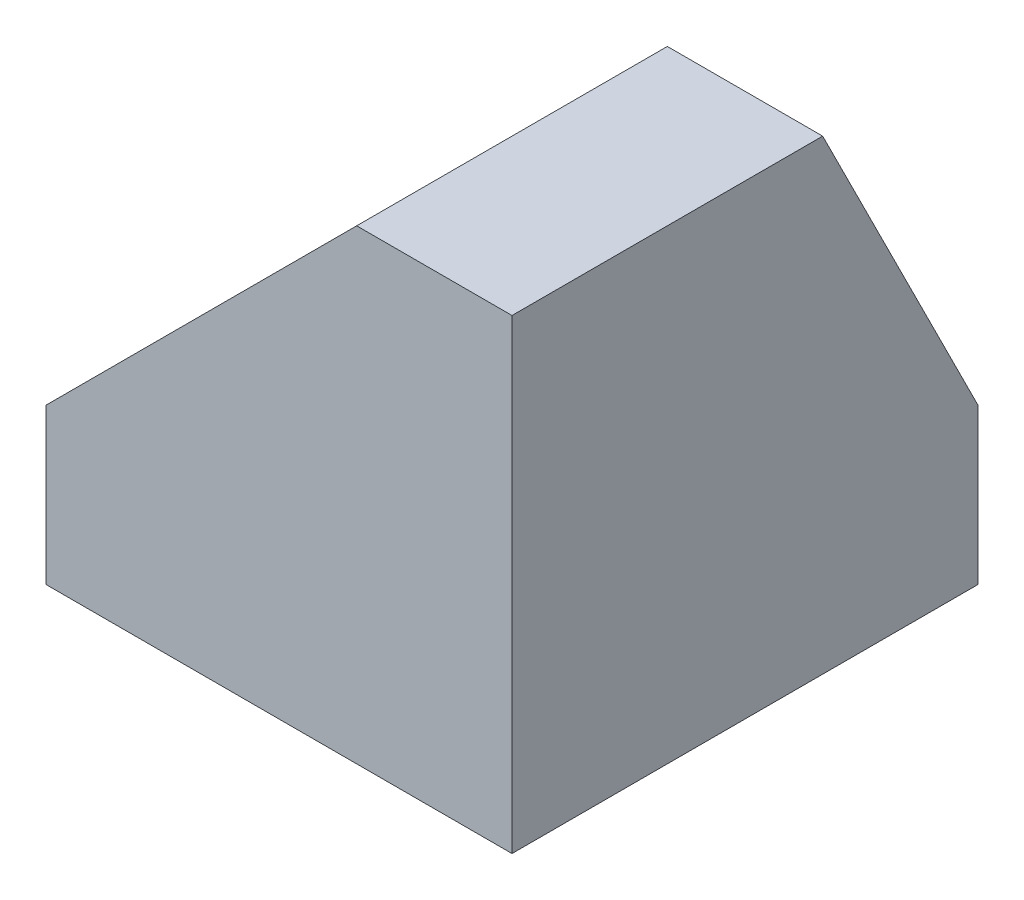
from build123d import *

# Parameters (mm, degrees)
SALIENTE_EXTRUIR1_DEPTH = 40
SALIENTE_EXTRUIR2_DEPTH = 20
SALIENTE_EXTRUIR3_DEPTH = 20


with BuildPart() as part:
    # Croquis1 → Saliente-Extruir1 (new body)
    with BuildSketch(Plane.XY):
        Polygon((0, 0), (60, 0), (60, 60), (40, 60), (0, 20), align=None)
    extrude(amount=-SALIENTE_EXTRUIR1_DEPTH)

    # Croquis2 → Saliente-Extruir2 (add)
    with BuildSketch(Plane(origin=(0, 0, -40), x_dir=(-1, 0, 0), z_dir=(0, 0, -1))):
        Polygon((-60, 20), (-40, 20), (0, 0), (-60, 0), align=None)
    extrude(amount=SALIENTE_EXTRUIR2_DEPTH)

    # Croquis3 → Saliente-Extruir3 (add)
    with BuildSketch(Plane(origin=(60, 0, 0), x_dir=(0, 0, -1), z_dir=(1, 0, 0))):
        Polygon((40, 60), (60, 20), (40, 20), align=None)
    extrude(amount=-SALIENTE_EXTRUIR3_DEPTH)


solid = part.part
